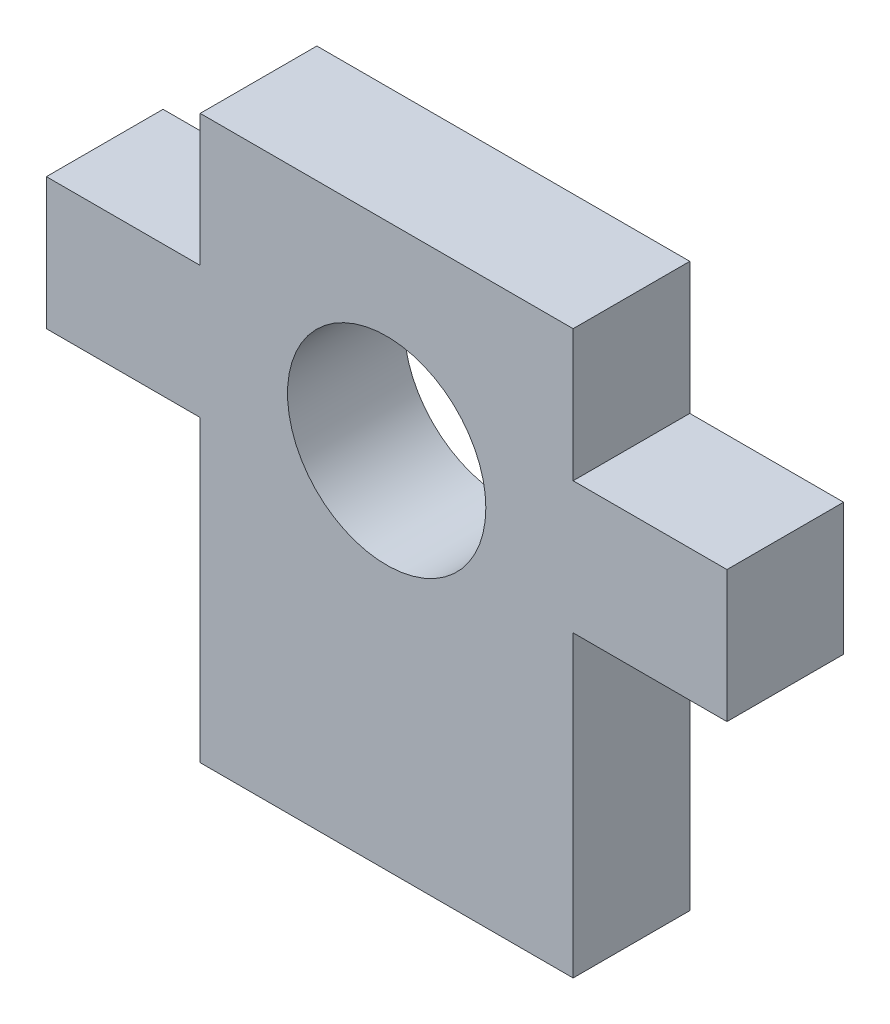
from build123d import *

# Parameters (mm, degrees)
SKETCH1_W           = 11.865
SKETCH1_H           = 10.16
SKETCH1_W_2         = 28.77
SKETCH1_H_2         = 23.06
BOSS_EXTRUDE1_DEPTH = 9
SKETCH3_R           = 7.65
CUT_EXTRUDE1_DEPTH  = 36.220996579


with BuildPart() as part:
    # Sketch1 → Boss-Extrude1 (new body)
    with BuildSketch(Plane.XY):
        with Locations((-20.3175, 6.45)):
            Rectangle(SKETCH1_W, SKETCH1_H)
        with Locations((0, -10.16)):
            Rectangle(SKETCH1_W_2, SKETCH1_H_2)
        with Locations((0, 6.45)):
            Rectangle(SKETCH1_W_2, SKETCH1_H)
        with Locations((0, 16.61)):
            Rectangle(SKETCH1_W_2, SKETCH1_H)
        with Locations((20.3175, 6.45)):
            Rectangle(SKETCH1_W, SKETCH1_H)
    extrude(amount=BOSS_EXTRUDE1_DEPTH)

    # Sketch3 → Cut-Extrude1 (cut, through all)
    with BuildSketch(Plane.XY.offset(9)):
        with Locations((0, 6.35)):
            Circle(SKETCH3_R)
    extrude(amount=-CUT_EXTRUDE1_DEPTH, mode=Mode.SUBTRACT)


solid = part.part
